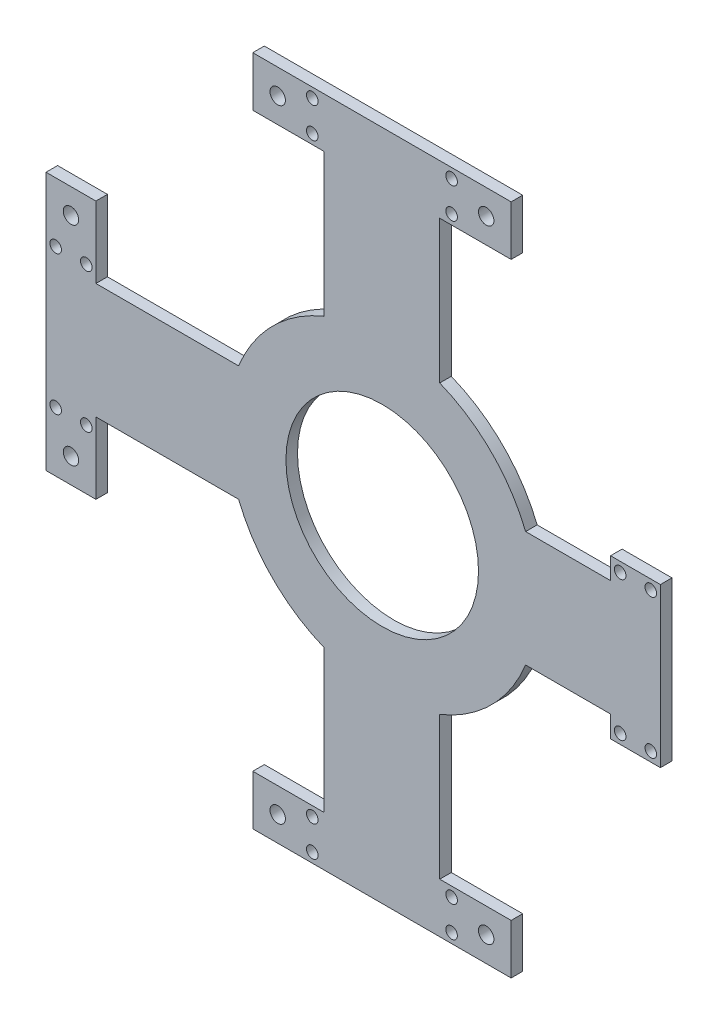
from build123d import *

# Parameters (mm, degrees)
CROQUIS1_R              = 25
SALIENTE_EXTRUIR1_DEPTH = 3
CROQUIS2_W              = 12.95
CROQUIS2_H              = 12.95
SALIENTE_EXTRUIR2_DEPTH = 3
CROQUIS3_R              = 2
CORTAR_EXTRUIR1_DEPTH   = 124.455998815
CROQUIS4_R              = 1.5
CORTAR_EXTRUIR2_DEPTH   = 124.455998815


with BuildPart() as part:
    # Croquis1 → Saliente-Extruir1 (new body)
    with BuildSketch(Plane.XY):
        with BuildLine():
            Line((-15.070986718, 74.306476298), (-15.070986718, 37.256476298))
            ThreePointArc((-15.070986718, 37.256476298), (-28.445175059, 28.391049341), (-37.285113206, 15))
            Line((-37.285113206, 15), (-74.335113206, 15))
            Line((-74.335113206, 15), (-74.335113206, 20.59))
            Line((-74.335113206, 20.59), (-87.285113206, 20.59))
            Line((-87.285113206, 20.59), (-87.285113206, -20.59))
            Line((-87.285113206, -20.59), (-74.335113206, -20.59))
            Line((-74.335113206, -20.59), (-74.335113206, -15))
            Line((-74.335113206, -15), (-37.285113206, -15))
            ThreePointArc((-37.285113206, -15), (-28.445175059, -28.391049341), (-15.070986718, -37.256476298))
            Line((-15.070986718, -37.256476298), (-15.070986718, -74.306476298))
            Line((-15.070986718, -74.306476298), (-20.660986718, -74.306476298))
            Line((-20.660986718, -74.306476298), (-20.660986718, -87.256476298))
            Line((-20.660986718, -87.256476298), (20.519013282, -87.256476298))
            Line((20.519013282, -87.256476298), (20.519013282, -74.306476298))
            Line((20.519013282, -74.306476298), (14.929013282, -74.306476298))
            Line((14.929013282, -74.306476298), (14.929013282, -37.256476298))
            ThreePointArc((14.929013282, -37.256476298), (28.353570497, -28.407666286), (37.22795272, -15))
            Line((37.22795272, -15), (59.27795272, -15))
            Line((59.27795272, -15), (59.27795272, -20.59))
            Line((59.27795272, -20.59), (72.22795272, -20.59))
            Line((72.22795272, -20.59), (72.22795272, 20.59))
            Line((72.22795272, 20.59), (59.27795272, 20.59))
            Line((59.27795272, 20.59), (59.27795272, 15))
            Line((59.27795272, 15), (37.22795272, 15))
            ThreePointArc((37.22795272, 15), (28.353570497, 28.407666286), (14.929013282, 37.256476298))
            Line((14.929013282, 37.256476298), (14.929013282, 74.306476298))
            Line((14.929013282, 74.306476298), (20.519013282, 74.306476298))
            Line((20.519013282, 74.306476298), (20.519013282, 87.256476298))
            Line((20.519013282, 87.256476298), (-20.660986718, 87.256476298))
            Line((-20.660986718, 87.256476298), (-20.660986718, 74.306476298))
            Line((-20.660986718, 74.306476298), (-15.070986718, 74.306476298))
        make_face()
        Circle(CROQUIS1_R, mode=Mode.SUBTRACT)
    extrude(amount=SALIENTE_EXTRUIR1_DEPTH)

    # Croquis2 → Saliente-Extruir2 (add)
    with BuildSketch(Plane(origin=(0, 0, 0), x_dir=(-1, 0, 0), z_dir=(0, 0, -1))):
        with Locations((-26.994013282, 80.781476298)):
            Rectangle(CROQUIS2_W, CROQUIS2_H)
        with Locations((27.135986718, 80.781476298)):
            Rectangle(CROQUIS2_W, CROQUIS2_H)
        with Locations((-26.994013282, -80.781476298)):
            Rectangle(CROQUIS2_W, CROQUIS2_H)
        with Locations((27.135986718, -80.781476298)):
            Rectangle(CROQUIS2_W, CROQUIS2_H)
        with Locations((80.810113206, 27.065)):
            Rectangle(CROQUIS2_W, CROQUIS2_H)
        with Locations((80.810113206, -27.065)):
            Rectangle(CROQUIS2_W, CROQUIS2_H)
    extrude(amount=-SALIENTE_EXTRUIR2_DEPTH)

    # Croquis3 → Cortar-Extruir1 (cut, through all)
    with BuildSketch(Plane(origin=(0, 0, 0), x_dir=(-1, 0, 0), z_dir=(0, 0, -1))):
        with Locations((-26.994013282, 80.781476298)):
            Circle(CROQUIS3_R)
        with Locations((27.135986718, 80.781476298)):
            Circle(CROQUIS3_R)
        with Locations((27.135986718, -80.781476298)):
            Circle(CROQUIS3_R)
        with Locations((-26.994013282, -80.781476298)):
            Circle(CROQUIS3_R)
        with Locations((80.810113206, -27.065)):
            Circle(CROQUIS3_R)
        with Locations((80.810113206, 27.065)):
            Circle(CROQUIS3_R)
    extrude(amount=-CORTAR_EXTRUIR1_DEPTH, mode=Mode.SUBTRACT)

    # Croquis4 → Cortar-Extruir2 (cut, through all)
    with BuildSketch(Plane(origin=(0, 0, 0), x_dir=(-1, 0, 0), z_dir=(0, 0, -1))):
        with Locations((-18.019013282, -84.756476298)):
            Circle(CROQUIS4_R)
        with Locations((-18.019013282, -76.806476298)):
            Circle(CROQUIS4_R)
        with Locations((18.160986718, -76.806476298)):
            Circle(CROQUIS4_R)
        with Locations((18.160986718, -84.756476298)):
            Circle(CROQUIS4_R)
        with Locations(Location((18.160986718, 76.806476298, 0), (0, 0, 180))):
            Circle(CROQUIS4_R)
        with Locations(Location((18.160986718, 84.756476298, 0), (0, 0, 180))):
            Circle(CROQUIS4_R)
        with Locations(Location((-18.019013282, 84.756476298, 0), (0, 0, 180))):
            Circle(CROQUIS4_R)
        with Locations(Location((-18.019013282, 76.806476298, 0), (0, 0, 180))):
            Circle(CROQUIS4_R)
        with Locations((76.835113206, -18.09)):
            Circle(CROQUIS4_R)
        with Locations(Location((84.785113206, -18.09, 0), (0, 0, 180))):
            Circle(CROQUIS4_R)
        with Locations(Location((76.835113206, 18.09, 0), (0, 0, 180))):
            Circle(CROQUIS4_R)
        with Locations((84.785113206, 18.09)):
            Circle(CROQUIS4_R)
        with Locations((-69.72795272, -18.09)):
            Circle(CROQUIS4_R)
        with Locations(Location((-61.77795272, -18.09, 0), (0, 0, 180))):
            Circle(CROQUIS4_R)
        with Locations(Location((-69.72795272, 18.09, 0), (0, 0, 180))):
            Circle(CROQUIS4_R)
        with Locations((-61.77795272, 18.09)):
            Circle(CROQUIS4_R)
    extrude(amount=-CORTAR_EXTRUIR2_DEPTH, mode=Mode.SUBTRACT)


solid = part.part
